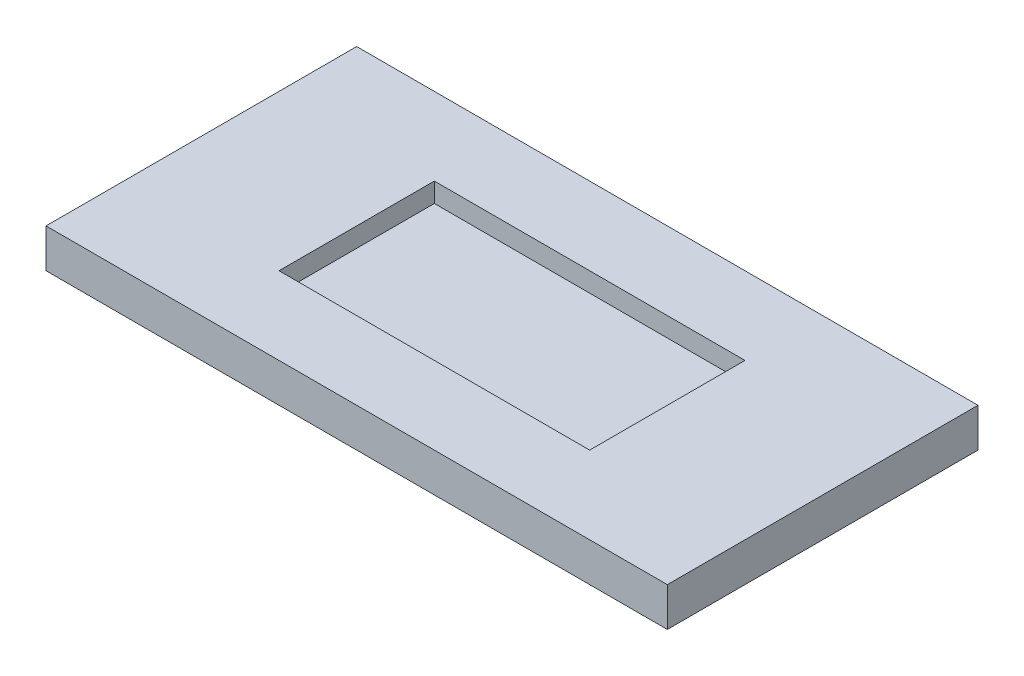
from build123d import *

# Parameters (mm, degrees)
SKETCH_1_W          = 320
SKETCH_1_H          = 160
EXTRUDE_1_DEPTH     = 20
SKETCH_2_W          = 160
SKETCH_2_H          = 80
CUT_EXTRUDE_1_DEPTH = 10


with BuildPart() as part:
    # Эскиз1 → Бобышка-Вытянуть1 (new body)
    with BuildSketch(Plane(origin=(0, 0, 0), x_dir=(1, 0, 0), z_dir=(0, 1, 0))):
        Rectangle(SKETCH_1_W, SKETCH_1_H)
    extrude(amount=EXTRUDE_1_DEPTH)

    # Эскиз2 → Вырез-Вытянуть1 (cut)
    with BuildSketch(Plane(origin=(0, 20, 0), x_dir=(1, 0, 0), z_dir=(0, 1, 0))):
        Rectangle(SKETCH_2_W, SKETCH_2_H)
    extrude(amount=-CUT_EXTRUDE_1_DEPTH, mode=Mode.SUBTRACT)


solid = part.part
